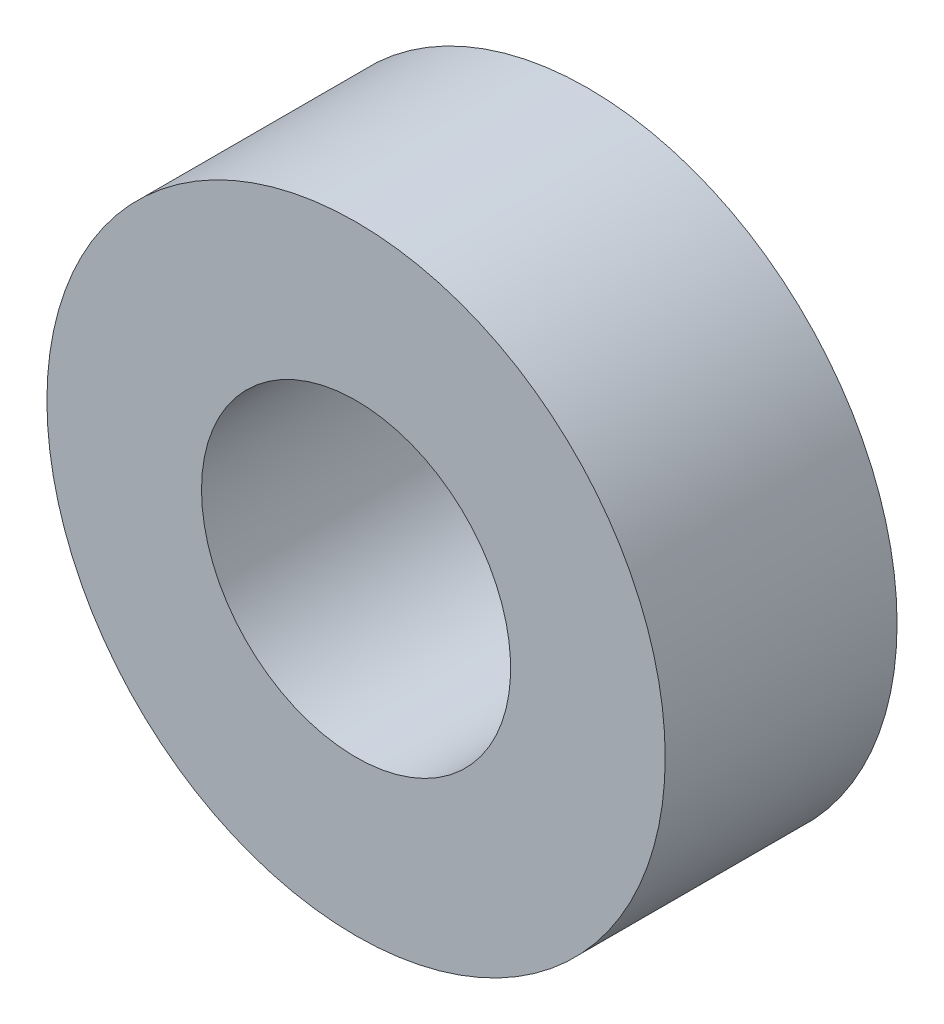
from build123d import *

# Parameters (mm, degrees)
SKETCH1_R      = 6.35
EXTRUDE1_DEPTH = 4.7625
SKETCH2_R      = 3.175
EXTRUDE2_DEPTH = 11.164959727


with BuildPart() as part:
    # Sketch1 → Extrude1 (new body)
    with BuildSketch(Plane.XY):
        with Locations(Location((0, 0, 0), (0, 0, 180))):
            Circle(SKETCH1_R)
    extrude(amount=EXTRUDE1_DEPTH)

    # Sketch2 → Extrude2 (cut, through all)
    with BuildSketch(Plane(origin=(0, 0, 0), x_dir=(-1, 0, 0), z_dir=(0, 0, -1))):
        Circle(SKETCH2_R)
    extrude(amount=-EXTRUDE2_DEPTH, mode=Mode.SUBTRACT)


solid = part.part
